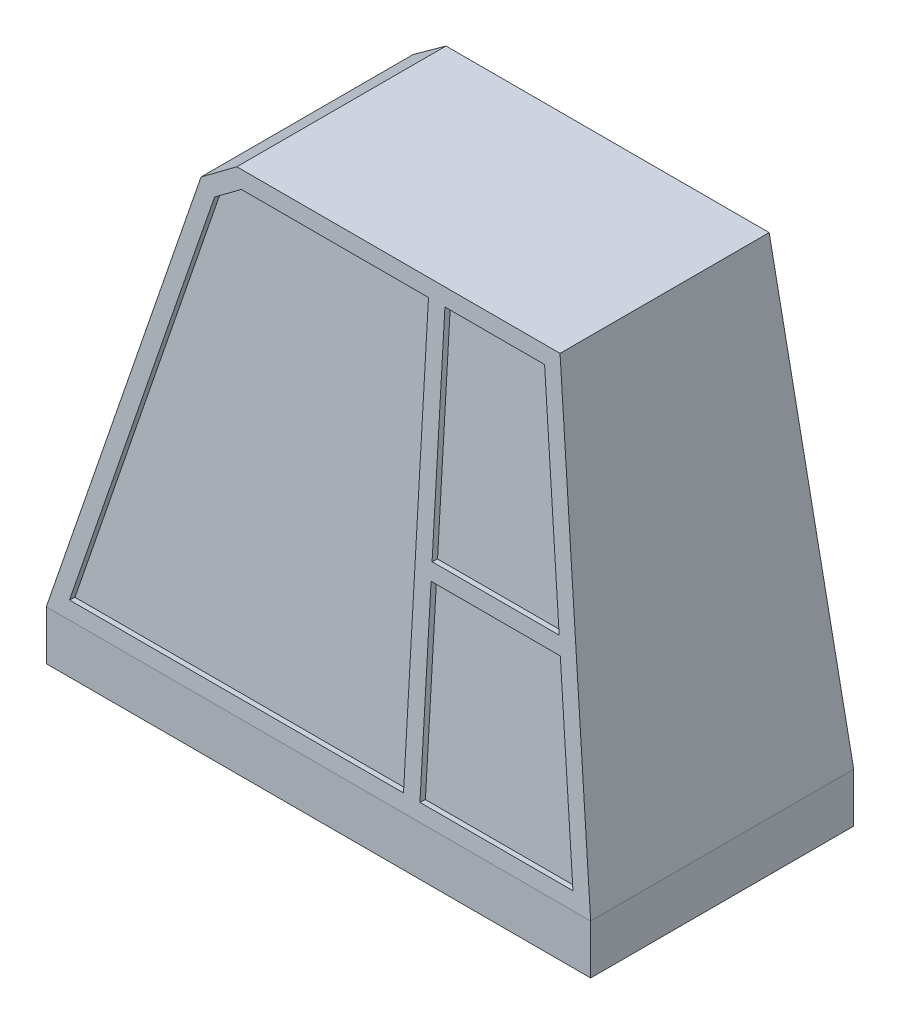
from build123d import *

# Parameters (mm, degrees)
BOSS_EXTRUDE1_DEPTH = 1219.2
CUT_EXTRUDE1_DEPTH  = 3633.417483209
CUT_EXTRUDE2_DEPTH  = 25.4
CUT_EXTRUDE3_DEPTH  = 25.4
CUT_EXTRUDE4_DEPTH  = 25.4


with BuildPart() as part:
    # Sketch2 → Boss-Extrude1 (new body)
    with BuildSketch(Plane.XY):
        Polygon((0, 228.6), (599.248370619, 2194.401873758), (758.16299584, 2311.4), (2256.189290748, 2311.4), (2522.982, 228.6), (2522.982, 0), (0, 0), align=None)
    extrude(amount=BOSS_EXTRUDE1_DEPTH)

    # Sketch3 → Cut-Extrude1 (cut, through all)
    with BuildSketch(Plane(origin=(2522.982, 0, 0), x_dir=(0, 0, -1), z_dir=(1, 0, 0))):
        Polygon((-1219.2, 2311.4), (-1219.2, 228.6), (-1094.292625206, 2311.4), align=None)
        Polygon((0, 2311.4), (-124.907374794, 2311.4), (0, 228.6), align=None)
    extrude(amount=-CUT_EXTRUDE1_DEPTH, mode=Mode.SUBTRACT)

    # Sketch4 → Cut-Extrude2 (cut)
    with BuildSketch(Plane(origin=(-63.760665506, 19.436584848, 0), x_dir=(0, 0, 1), z_dir=(-0.9565435532915122, 0.2915894899622553, 0))):
        Polygon((1029.355029429, 2197.575492424), (1138.503531145, 294.865856282), (80.696468855, 294.865856282), (189.844970571, 2197.575492424), align=None)
    extrude(amount=-CUT_EXTRUDE2_DEPTH, mode=Mode.SUBTRACT)

    # Sketch5 → Cut-Extrude3 (cut)
    with BuildSketch(Plane(origin=(0, 73.673705722, 1228.491068132), x_dir=(1, 0, 0), z_dir=(0, 0.0598633395783769, 0.9982065821134041))):
        Polygon((664.797989738, 2078.200755327), (783.224260037, 2165.546682876), (1651, 2165.546682876), (1651, 231.404641057), (102.836573264, 231.404641057), align=None)
        Polygon((2189.112119554, 2165.546682876), (2316.297526218, 1170.850467771), (1727.2, 1170.850467771), (1727.2, 2165.546682876), align=None)
        Polygon((2436.418421116, 231.404641057), (1727.2, 231.404641057), (1727.2, 1094.650467771), (2326.040730063, 1094.650467771), align=None)
    extrude(amount=-CUT_EXTRUDE3_DEPTH, mode=Mode.SUBTRACT)

    # Sketch6 → Cut-Extrude4 (cut)
    with BuildSketch(Plane(origin=(0, 0.819215401, -13.660216935), x_dir=(-1, 0, 0), z_dir=(0, 0.0598633395783769, -0.9982065821134041))):
        Polygon((-2189.112119554, 2238.53206649), (-2312.765270335, 1271.461045581), (-1727.2, 1271.461045581), (-1727.2, 2238.53206649), align=None)
        Polygon((-2436.418421116, 304.390024671), (-1727.2, 304.390024671), (-1727.2, 1195.261045581), (-2322.50847418, 1195.261045581), align=None)
        Polygon((-102.836573264, 304.390024671), (-664.797989738, 2151.186138941), (-783.224260037, 2238.53206649), (-1651, 2238.53206649), (-1651, 304.390024671), align=None)
    extrude(amount=-CUT_EXTRUDE4_DEPTH, mode=Mode.SUBTRACT)


solid = part.part
